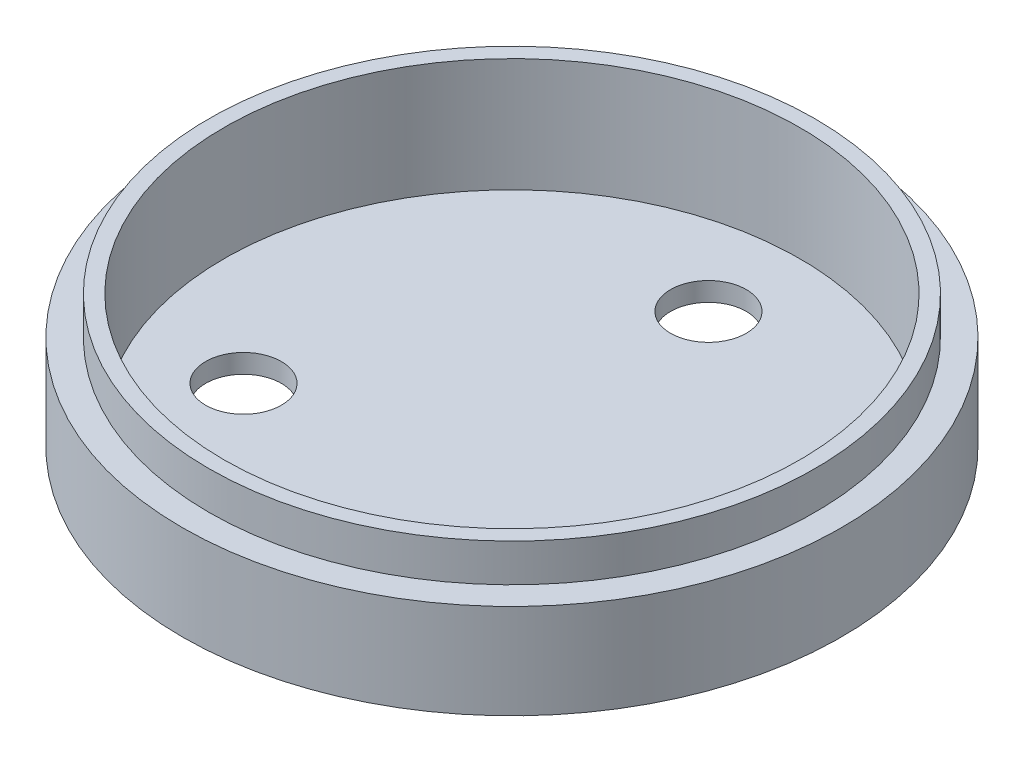
from build123d import *

# Parameters (mm, degrees)
SKETCH1_R           = 87
SKETCH1_R_2         = 10
BOSS_EXTRUDE1_DEPTH = 5
SKETCH2_R           = 80
SKETCH2_R_2         = 76
BOSS_EXTRUDE2_DEPTH = 30
SKETCH3_R           = 87
SKETCH3_R_2         = 80
BOSS_EXTRUDE3_DEPTH = 20


with BuildPart() as part:
    # Sketch1 → Boss-Extrude1 (new body)
    with BuildSketch(Plane(origin=(0, 0, 0), x_dir=(1, 0, 0), z_dir=(0, 1, 0))):
        with Locations(Location((0, 0, 0), (0, 0, 270))):
            Circle(SKETCH1_R)
        with Locations(Location((0, 51.875, 0), (0, 0, 270))):
            Circle(SKETCH1_R_2, mode=Mode.SUBTRACT)
        with Locations(Location((44.926567821, -25.936633975, 0), (0, 0, 270))):
            Circle(SKETCH1_R_2, mode=Mode.SUBTRACT)
        with Locations(Location((-44.923567821, -25.938366025, 0), (0, 0, 270))):
            Circle(SKETCH1_R_2, mode=Mode.SUBTRACT)
    extrude(amount=BOSS_EXTRUDE1_DEPTH)

    # Sketch2 → Boss-Extrude2 (add)
    with BuildSketch(Plane(origin=(0, 5, 0), x_dir=(1, 0, 0), z_dir=(0, 1, 0))):
        with Locations(Location((0, 0, 0), (0, 0, 270))):
            Circle(SKETCH2_R)
        with Locations(Location((0, 0, 0), (0, 0, 270))):
            Circle(SKETCH2_R_2, mode=Mode.SUBTRACT)
    extrude(amount=BOSS_EXTRUDE2_DEPTH)

    # Sketch3 → Boss-Extrude3 (add)
    with BuildSketch(Plane(origin=(0, 5, 0), x_dir=(1, 0, 0), z_dir=(0, 1, 0))):
        with Locations(Location((0, 0, 0), (0, 0, 270))):
            Circle(SKETCH3_R)
        with Locations(Location((0, 0, 0), (0, 0, 270))):
            Circle(SKETCH3_R_2, mode=Mode.SUBTRACT)
    extrude(amount=BOSS_EXTRUDE3_DEPTH)


solid = part.part
